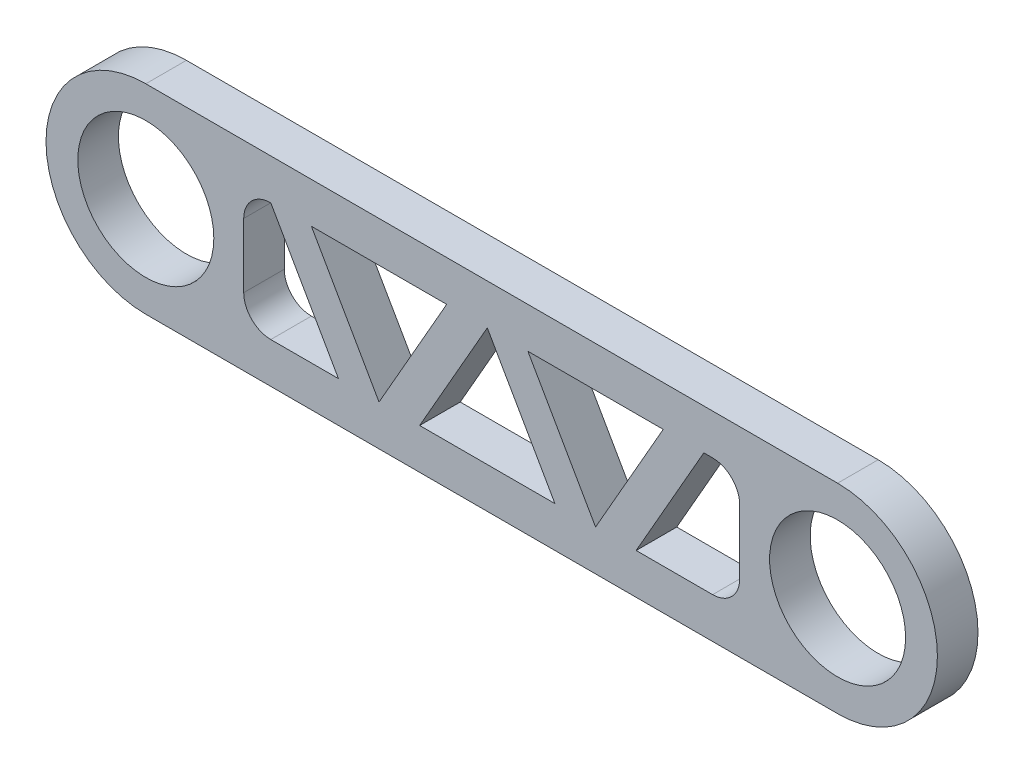
from build123d import *

# Parameters (mm, degrees)
BOSS_EXTRUDE2_DEPTH = 12
CUT_EXTRUDE4_DEPTH  = 12
SKETCH8_R           = 20.1
CUT_EXTRUDE5_DEPTH  = 19
SKETCH9_R           = 20.1
CUT_EXTRUDE6_DEPTH  = 19


with BuildPart() as part:
    # Sketch1 → Boss-Extrude2 (new body)
    with BuildSketch(Plane.XY):
        with BuildLine():
            Line((0, 29.5), (204.48, 29.5))
            ThreePointArc((204.48, 29.5), (233.98, 0), (204.48, -29.5))
            Line((204.48, -29.5), (0, -29.5))
            ThreePointArc((0, -29.5), (-29.5, 0), (0, 29.5))
        make_face()
    extrude(amount=-BOSS_EXTRUDE2_DEPTH)

    # Sketch7 → Cut-Extrude4 (cut)
    with BuildSketch(Plane.XY):
        with BuildLine():
            Line((56.938938215, -17.5), (36.938938215, 17.5))
            ThreePointArc((36.938938215, 17.5), (31.282083966, 15.156854249), (28.938938215, 9.5))
            Line((28.938938215, 9.5), (28.938938215, -9.5))
            ThreePointArc((28.938938215, -9.5), (31.282083966, -15.156854249), (36.938938215, -17.5))
            Line((36.938938215, -17.5), (56.938938215, -17.5))
        make_face()
        Polygon((88.938938215, 17.5), (48.938938215, 17.5), (68.938938215, -17.5), align=None)
        Polygon((120.938938215, -17.5), (100.938938215, 17.5), (80.938938215, -17.5), align=None)
        Polygon((152.938938215, 17.5), (112.938938215, 17.5), (132.938938215, -17.5), align=None)
        with BuildLine():
            Line((167.541061785, 17.5), (164.938938215, 17.5))
            Line((164.938938215, 17.5), (144.938938215, -17.5))
            Line((144.938938215, -17.5), (167.541061785, -17.5))
            ThreePointArc((167.541061785, -17.5), (173.197916034, -15.156854249), (175.541061785, -9.5))
            Line((175.541061785, -9.5), (175.541061785, 9.5))
            ThreePointArc((175.541061785, 9.5), (173.197916034, 15.156854249), (167.541061785, 17.5))
        make_face()
    extrude(amount=-CUT_EXTRUDE4_DEPTH, mode=Mode.SUBTRACT)

    # Sketch8 → Cut-Extrude5 (cut)
    with BuildSketch(Plane.XY):
        Circle(SKETCH8_R)
    extrude(amount=-CUT_EXTRUDE5_DEPTH, mode=Mode.SUBTRACT)

    # Sketch9 → Cut-Extrude6 (cut)
    with BuildSketch(Plane.XY):
        with Locations((204.48, 0)):
            Circle(SKETCH9_R)
    extrude(amount=-CUT_EXTRUDE6_DEPTH, mode=Mode.SUBTRACT)


solid = part.part
